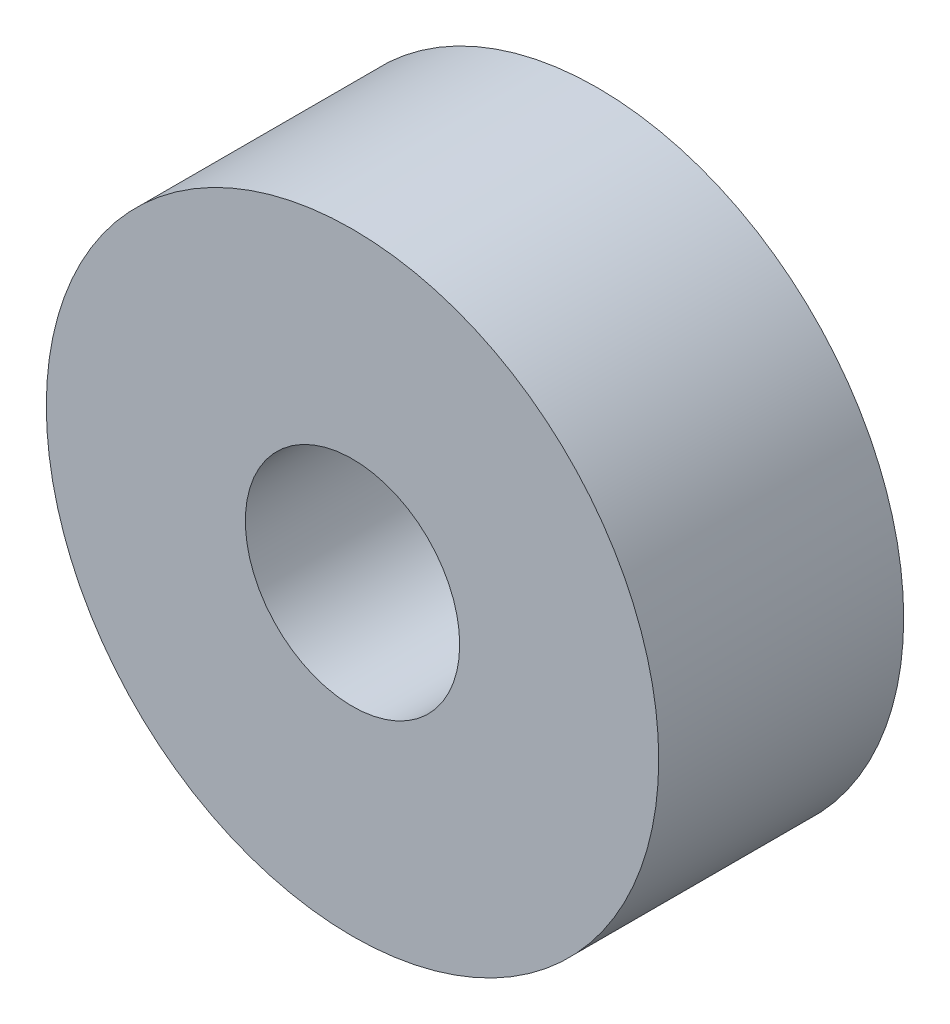
from build123d import *

# Parameters (mm, degrees)
SKETCH1_R           = 25.4
SKETCH1_R_2         = 8.89
BOSS_EXTRUDE1_DEPTH = 20.32


with BuildPart() as part:
    # Sketch1 → Boss-Extrude1 (new body)
    with BuildSketch(Plane.XY):
        Circle(SKETCH1_R)
        Circle(SKETCH1_R_2, mode=Mode.SUBTRACT)
    extrude(amount=BOSS_EXTRUDE1_DEPTH)


solid = part.part
